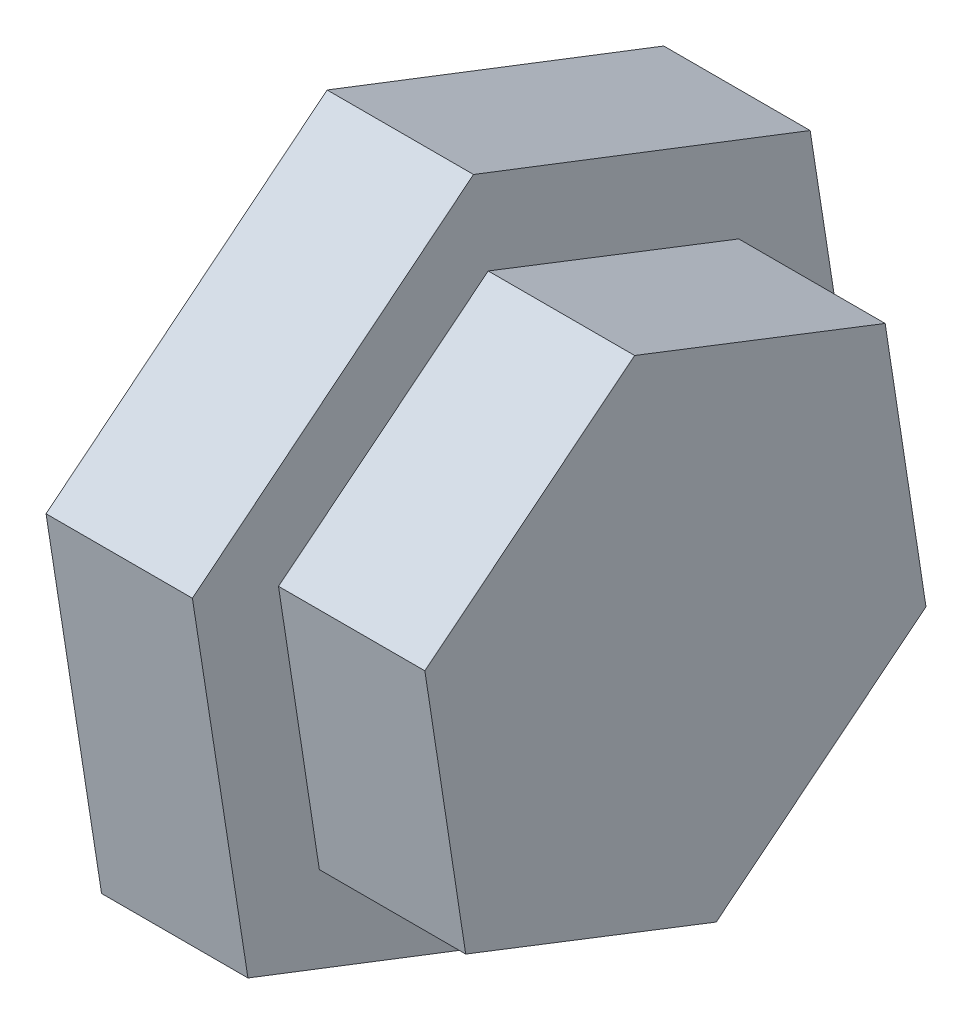
from build123d import *

# Parameters (mm, degrees)
BOSS_EXTRUDE1_DEPTH = 0.5
BOSS_EXTRUDE2_DEPTH = 0.5


with BuildPart() as part:
    # Sketch1 → Boss-Extrude1 (new body)
    with BuildSketch(Plane(origin=(0, 0, 0), x_dir=(0, 0, -1), z_dir=(1, 0, 0))):
        Polygon((0.189691839, -1.218308397), (1.149931941, -0.444876247), (0.960240102, 0.77343215), (-0.189691839, 1.218308397), (-1.149931941, 0.444876247), (-0.960240102, -0.77343215), align=None)
    extrude(amount=BOSS_EXTRUDE1_DEPTH)

    # Sketch2 → Boss-Extrude2 (add)
    with BuildSketch(Plane(origin=(0.5, 0, 0), x_dir=(0, 0, -1), z_dir=(1, 0, 0))):
        Polygon((0.139418895, -0.907754159), (0.855847609, -0.333136775), (0.716428714, 0.574617384), (-0.139418895, 0.907754159), (-0.855847609, 0.333136775), (-0.716428714, -0.574617384), align=None)
    extrude(amount=BOSS_EXTRUDE2_DEPTH)


solid = part.part
